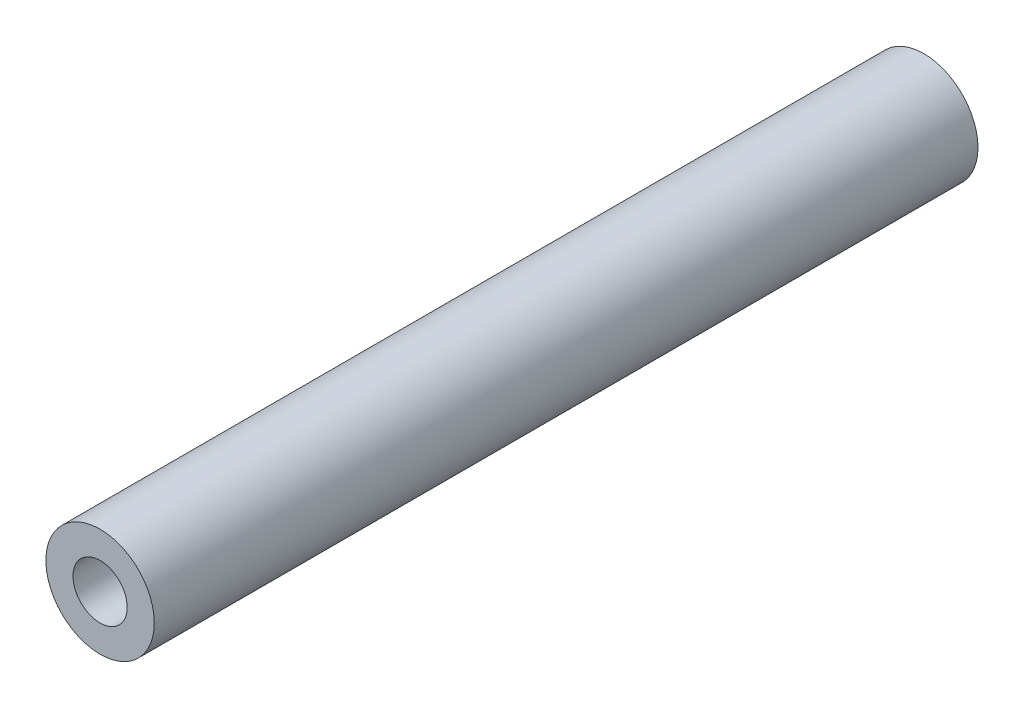
from build123d import *

# Parameters (mm, degrees)
SKETCH_1_R         = 2.5
EXTRUDE_1_DEPTH    = 38
HOLE_WIZARD_M3_1_D = 2.5


with BuildPart() as part:
    # 草图1 → 凸台-拉伸1 (new body)
    with BuildSketch(Plane.XY):
        Circle(SKETCH_1_R)
    extrude(amount=EXTRUDE_1_DEPTH)

    # M3 螺纹孔1 (through all)
    with Locations(Plane.XY.offset(38)):
        with Locations((0, 0)):
            Hole(HOLE_WIZARD_M3_1_D / 2)


solid = part.part
